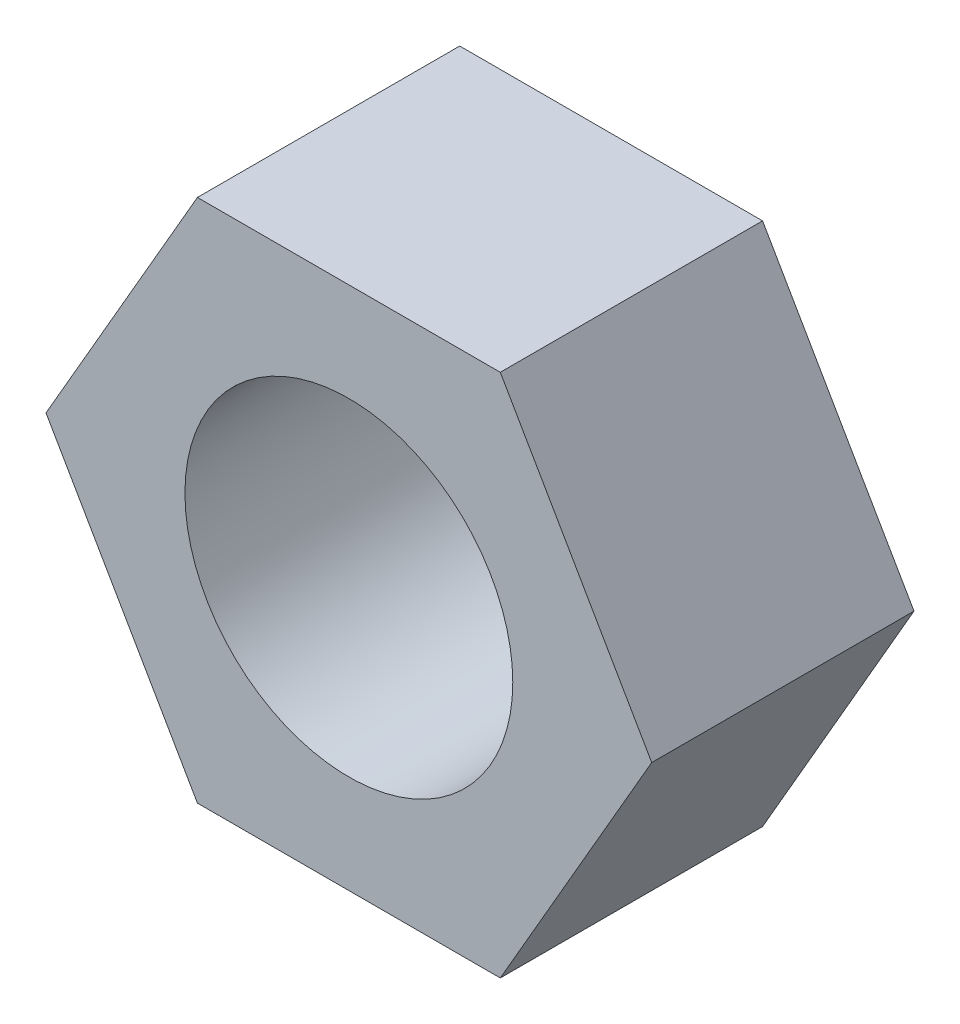
from build123d import *

# Parameters (mm, degrees)
HEX_2_DEPTH = 4
SKETCH2_R   = 2.5
BORE_DEPTH  = 4


with BuildPart() as part:
    # Sketch1 → Hex 2 (new body)
    with BuildSketch(Plane.XY):
        Polygon((4.618802154, 0), (2.309401077, 4), (-2.309401077, 4), (-4.618802154, 0), (-2.309401077, -4), (2.309401077, -4), align=None)
    extrude(amount=HEX_2_DEPTH)

    # Sketch2 → Bore (cut)
    with BuildSketch(Plane.XY):
        Circle(SKETCH2_R)
    extrude(amount=BORE_DEPTH, mode=Mode.SUBTRACT)


solid = part.part
